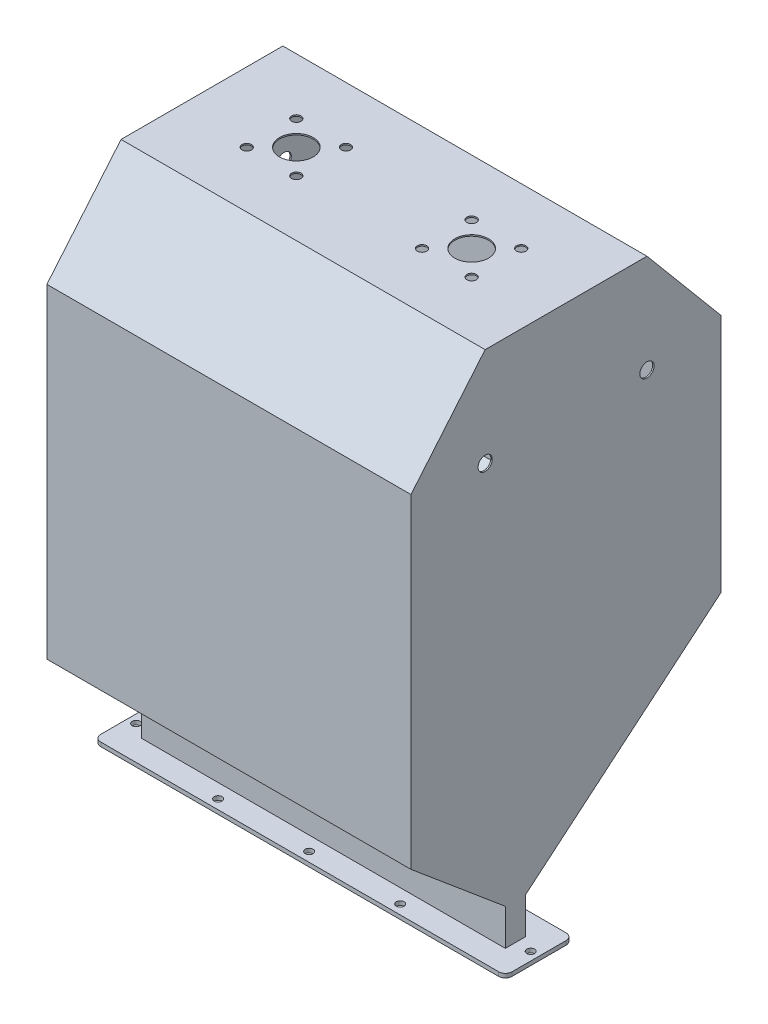
from build123d import *

# Parameters (mm, degrees)
BOSS_EXTRUDE1_DEPTH                   = 135
SHELL1_T                              = -1
SKETCH16_W                            = 305
SKETCH16_H                            = 50
SKETCH16_W_2                          = 270
SKETCH16_H_2                          = 15
BOSS_EXTRUDE2_DEPTH                   = 3
SKETCH18_W                            = 2.9
SKETCH18_H                            = 3
M5_CLEARANCE_HOLE1_AT_2_COUNT         = 2
M5_CLEARANCE_HOLE1_AT_2_PITCH         = 67.49253334
M5_CLEARANCE_HOLE1_AT_3_COUNT         = 2
M5_CLEARANCE_HOLE1_AT_3_PITCH         = 134.98506668
M5_CLEARANCE_HOLE1_AT_4_COUNT         = 2
M5_CLEARANCE_HOLE1_AT_4_PITCH         = 214.5489392
M5_CLEARANCE_HOLE1_AT_5_COUNT         = 2
M5_CLEARANCE_HOLE1_AT_5_PITCH         = 139.703143223
M5_CLEARANCE_HOLE1_AT_6_COUNT         = 2
M5_CLEARANCE_HOLE1_AT_6_PITCH         = 76.493411851
M5_CLEARANCE_HOLE1_AT_7_COUNT         = 2
M5_CLEARANCE_HOLE1_AT_7_PITCH         = 36
M5_CLEARANCE_HOLE1_AT_8_COUNT         = 2
M5_CLEARANCE_HOLE1_AT_8_PITCH         = 80.836976696
SKETCH19_R                            = 12.5
CUT_EXTRUDE1_DEPTH                    = 10
FILLET1_R                             = 5
F_7_0_7_DIAMETER_HOLE1_AT_2_COUNT     = 2
F_7_0_7_DIAMETER_HOLE1_AT_2_PITCH     = 36.769552622
F_7_0_7_DIAMETER_HOLE1_AT_3_COUNT     = 2
F_7_0_7_DIAMETER_HOLE1_AT_3_PITCH     = 36.769552622
F_7_0_7_DIAMETER_HOLE1_AT_4_COUNT     = 2
F_7_0_7_DIAMETER_HOLE1_AT_4_PITCH     = 52
SKETCH23_R                            = 7.4
CUT_EXTRUDE2_DEPTH                    = 10
F_10_5_10_5_DIAMETER_HOLE1_AT_2_COUNT = 2
F_10_5_10_5_DIAMETER_HOLE1_AT_2_PITCH = 120


with BuildPart() as part:
    # Sketch1 → Boss-Extrude1 (new, symmetric)
    with BuildSketch(Plane(origin=(0, 0, 0), x_dir=(0, 0, -1), z_dir=(1, 0, 0))):
        Polygon((-115, 171.340041203), (-115, -69.376537021), (-45, -128.113511204), (-45, -158.113511204), (-30, -158.113511204), (-30, -128.113511204), (115, -6.444064683), (115, 171.340041203), (60, 236.886488796), (-60, 236.886488796), align=None)
    extrude(amount=BOSS_EXTRUDE1_DEPTH, both=True)

    # Shell1
    shell1_openings = [part.faces().sort_by_distance(p)[0] for p in [
        (0, -158.113511204, 37.5),
    ]]
    offset(amount=SHELL1_T, openings=shell1_openings, kind=Kind.INTERSECTION)

    # Sketch19 → Cut-Extrude1 (cut)
    with BuildSketch(Plane(origin=(0, 236.886488796, 0), x_dir=(1, 0, 0), z_dir=(0, 1, 0))):
        with Locations(Location((65, 0, 0), (0, 0, 270))):
            Circle(SKETCH19_R)
        with Locations(Location((-65, 0, 0), (0, 0, 270))):
            Circle(SKETCH19_R)
    extrude(amount=-CUT_EXTRUDE1_DEPTH, mode=Mode.SUBTRACT)

    # Sketch22 → Ø7.0 (7) Diameter Hole1 (revolve, cut)
    with BuildSketch(Plane(origin=(46.615223689, 236.886488796, -18.384776311), x_dir=(0, 0, 1), z_dir=(1, 0, 0))):
        Polygon((0, 0), (0, 22.103012167), (3.5, 20), (3.5, 0), align=None)
    f_7_0_7_diameter_hole1 = revolve(axis=Axis((46.615223689, 243.236488796, -18.384776311), (0, -1, 0)), mode=Mode.SUBTRACT)

    # Ø7.0 (7) Diameter Hole1 at 2: Ø7.0 (7) Diameter Hole1 ×2
    with Locations(*[(i * F_7_0_7_DIAMETER_HOLE1_AT_2_PITCH, 0, 0) for i in range(1, F_7_0_7_DIAMETER_HOLE1_AT_2_COUNT)]):
        add(f_7_0_7_diameter_hole1, mode=Mode.SUBTRACT)

    # Ø7.0 (7) Diameter Hole1 at 3: Ø7.0 (7) Diameter Hole1 ×2
    with Locations(*[(0, 0, i * F_7_0_7_DIAMETER_HOLE1_AT_3_PITCH) for i in range(1, F_7_0_7_DIAMETER_HOLE1_AT_3_COUNT)]):
        add(f_7_0_7_diameter_hole1, mode=Mode.SUBTRACT)

    # Ø7.0 (7) Diameter Hole1 at 4: Ø7.0 (7) Diameter Hole1 ×2
    with Locations(*[Vector(0.7071067811865488, 0, 0.7071067811865464) * (i * F_7_0_7_DIAMETER_HOLE1_AT_4_PITCH) for i in range(1, F_7_0_7_DIAMETER_HOLE1_AT_4_COUNT)]):
        add(f_7_0_7_diameter_hole1, mode=Mode.SUBTRACT)

    # Mirror1: Ø7.0 (7) Diameter Hole1 across plane
    add(f_7_0_7_diameter_hole1.mirror(Plane(origin=(0, 0, 0), x_dir=(0, 0, 1), z_dir=(1, 0, 0))), mode=Mode.SUBTRACT)

    # Mirror1 copy 1 sketch → Mirror1 copy 1 (revolve, cut)
    with BuildSketch(Plane(origin=(-83.384776311, 236.886488796, -18.384776311), x_dir=(0, 0, 1), z_dir=(-1, 0, 0))):
        Polygon((0, 0), (0, -22.103012167), (3.5, -20), (3.5, 0), align=None)
    revolve(axis=Axis((-83.384776311, 243.236488796, -18.384776311), (0, 1, 0)), mode=Mode.SUBTRACT)

    # Mirror1 copy 2 sketch → Mirror1 copy 2 (revolve, cut)
    with BuildSketch(Plane(origin=(-46.615223689, 236.886488796, 18.384776311), x_dir=(0, 0, 1), z_dir=(-1, 0, 0))):
        Polygon((0, 0), (0, -22.103012167), (3.5, -20), (3.5, 0), align=None)
    revolve(axis=Axis((-46.615223689, 243.236488796, 18.384776311), (0, 1, 0)), mode=Mode.SUBTRACT)

    # Mirror1 copy 3 sketch → Mirror1 copy 3 (revolve, cut)
    with BuildSketch(Plane(origin=(-83.384776311, 236.886488796, 18.384776311), x_dir=(0, 0, 1), z_dir=(-1, 0, 0))):
        Polygon((0, 0), (0, -22.103012167), (3.5, -20), (3.5, 0), align=None)
    revolve(axis=Axis((-83.384776311, 243.236488796, 18.384776311), (0, 1, 0)), mode=Mode.SUBTRACT)

    # Sketch23 → Cut-Extrude2 (cut)
    with BuildSketch(Plane(origin=(0, -97.338268922, -6.676505552), x_dir=(1, 0, 0), z_dir=(0, 0.7660444431189791, 0.642787609686538))):
        with Locations(Location((0, -12.877777695, 0), (0, 0, 270))):
            Circle(SKETCH23_R)
    extrude(amount=CUT_EXTRUDE2_DEPTH, mode=Mode.SUBTRACT)

    # Sketch25 → Ø10.5 (10.5) Diameter Hole1 (revolve, cut)
    with BuildSketch(Plane(origin=(135, 163.886488796, -60), x_dir=(0, 0, -1), z_dir=(0, 1, 0))):
        Polygon((0, 0), (0, 8.15451825), (5.25, 5), (5.25, 0), align=None)
    f_10_5_10_5_diameter_hole1 = revolve(axis=Axis((141.35, 163.886488796, -60), (-1, 0, 0)), mode=Mode.SUBTRACT)

    # Ø10.5 (10.5) Diameter Hole1 at 2: Ø10.5 (10.5) Diameter Hole1 ×2
    with Locations(*[(0, 0, i * F_10_5_10_5_DIAMETER_HOLE1_AT_2_PITCH) for i in range(1, F_10_5_10_5_DIAMETER_HOLE1_AT_2_COUNT)]):
        add(f_10_5_10_5_diameter_hole1, mode=Mode.SUBTRACT)

    # Mirror2: Ø10.5 (10.5) Diameter Hole1 across plane
    add(f_10_5_10_5_diameter_hole1.mirror(Plane(origin=(0, 0, 0), x_dir=(0, 0, 1), z_dir=(1, 0, 0))), mode=Mode.SUBTRACT)

    # Mirror2 copy 1 sketch → Mirror2 copy 1 (revolve, cut)
    with BuildSketch(Plane(origin=(-135, 163.886488796, 60), x_dir=(0, 0, -1), z_dir=(0, 1, 0))):
        Polygon((0, 0), (0, -8.15451825), (5.25, -5), (5.25, 0), align=None)
    revolve(axis=Axis((-141.35, 163.886488796, 60), (-1, 0, 0)), mode=Mode.SUBTRACT)


with BuildPart() as body_2:
    # Sketch16 → Boss-Extrude2 (new body)
    with BuildSketch(Plane.XZ.offset(158.113511204)):
        with Locations((0, 37.5)):
            Rectangle(SKETCH16_W, SKETCH16_H)
        with Locations((0, 37.5)):
            Rectangle(SKETCH16_W_2, SKETCH16_H_2, mode=Mode.SUBTRACT)
    extrude(amount=-BOSS_EXTRUDE2_DEPTH)

    # Sketch18 → M5 Clearance Hole1 (revolve, cut)
    with BuildSketch(Plane(origin=(67.49253334, -155.113511204, 19.5), x_dir=(0, 0, 1), z_dir=(1, 0, 0))):
        with Locations((1.45, 1.5)):
            Rectangle(SKETCH18_W, SKETCH18_H)
    m5_clearance_hole1 = revolve(axis=Axis((67.49253334, -148.763511204, 19.5), (0, -1, 0)), mode=Mode.SUBTRACT)

    # M5 Clearance Hole1 at 2: M5 Clearance Hole1 ×2
    with Locations(*[(-i * M5_CLEARANCE_HOLE1_AT_2_PITCH, 0, 0) for i in range(1, M5_CLEARANCE_HOLE1_AT_2_COUNT)]):
        add(m5_clearance_hole1, mode=Mode.SUBTRACT)

    # M5 Clearance Hole1 at 3: M5 Clearance Hole1 ×2
    with Locations(*[(-i * M5_CLEARANCE_HOLE1_AT_3_PITCH, 0, 0) for i in range(1, M5_CLEARANCE_HOLE1_AT_3_COUNT)]):
        add(m5_clearance_hole1, mode=Mode.SUBTRACT)

    # M5 Clearance Hole1 at 4: M5 Clearance Hole1 ×2
    with Locations(*[Vector(-0.996474436727455, 0, 0.083896942427608) * (i * M5_CLEARANCE_HOLE1_AT_4_PITCH) for i in range(1, M5_CLEARANCE_HOLE1_AT_4_COUNT)]):
        add(m5_clearance_hole1, mode=Mode.SUBTRACT)

    # M5 Clearance Hole1 at 5: M5 Clearance Hole1 ×2
    with Locations(*[Vector(-0.9662278425887242, 0, 0.25768926288524274) * (i * M5_CLEARANCE_HOLE1_AT_5_PITCH) for i in range(1, M5_CLEARANCE_HOLE1_AT_5_COUNT)]):
        add(m5_clearance_hole1, mode=Mode.SUBTRACT)

    # M5 Clearance Hole1 at 6: M5 Clearance Hole1 ×2
    with Locations(*[Vector(-0.8823313237899557, 0, 0.4706287656519355) * (i * M5_CLEARANCE_HOLE1_AT_6_PITCH) for i in range(1, M5_CLEARANCE_HOLE1_AT_6_COUNT)]):
        add(m5_clearance_hole1, mode=Mode.SUBTRACT)

    # M5 Clearance Hole1 at 7: M5 Clearance Hole1 ×2
    with Locations(*[(0, 0, i * M5_CLEARANCE_HOLE1_AT_7_PITCH) for i in range(1, M5_CLEARANCE_HOLE1_AT_7_COUNT)]):
        add(m5_clearance_hole1, mode=Mode.SUBTRACT)

    # M5 Clearance Hole1 at 8: M5 Clearance Hole1 ×2
    with Locations(*[Vector(0.9748937909476473, 0, 0.22267037605331547) * (i * M5_CLEARANCE_HOLE1_AT_8_PITCH) for i in range(1, M5_CLEARANCE_HOLE1_AT_8_COUNT)]):
        add(m5_clearance_hole1, mode=Mode.SUBTRACT)

    # Fillet1
    fillet1_edges = [body_2.edges().sort_by_distance(p)[0] for p in [
        (-152.5, -156.613511204, 62.5),
        (152.5, -156.613511204, 62.5),
        (152.5, -156.613511204, 12.5),
        (-152.5, -156.613511204, 12.5),
    ]]
    fillet(fillet1_edges, radius=FILLET1_R)


solid = Compound([part.part, body_2.part])
